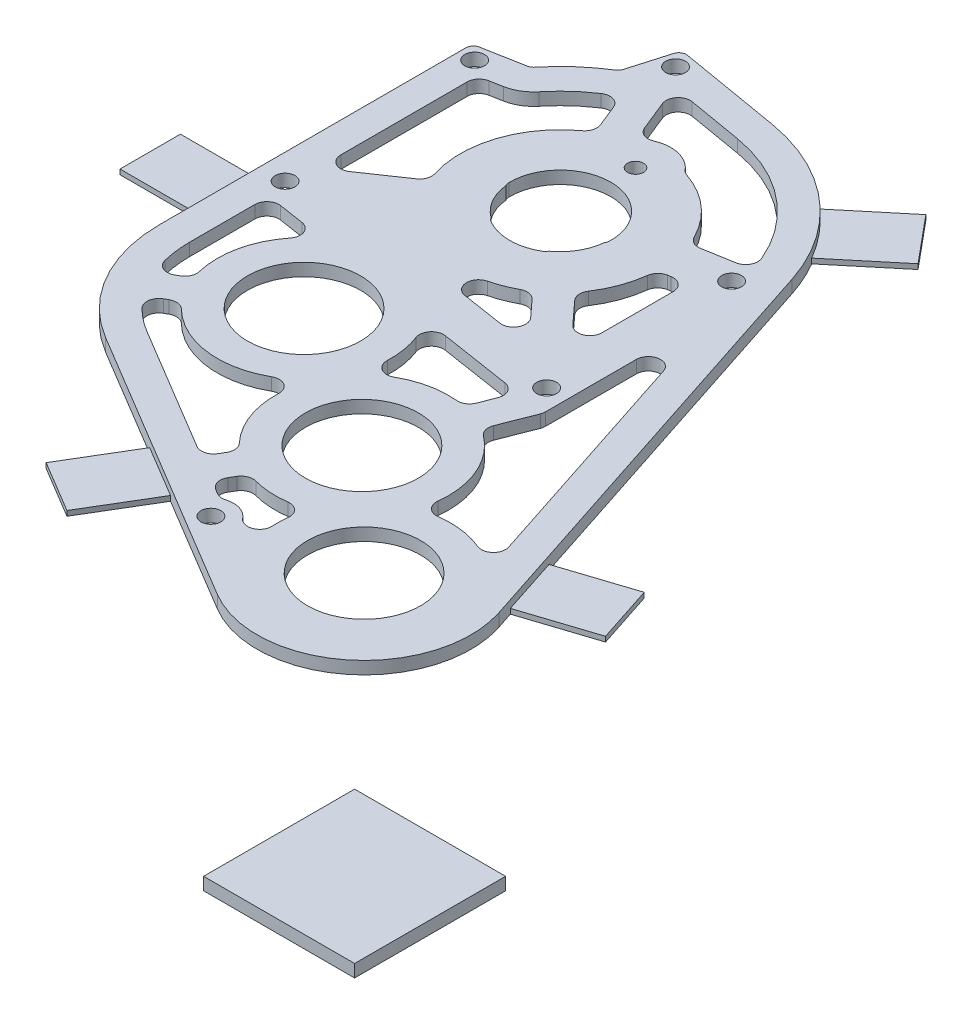
from build123d import *

# Parameters (mm, degrees)
SKETCH12_R                                   = 14.26845
BOSS_EXTRUDE2_DEPTH                          = 3.175
F_10_CLEARANCE_HOLE1_D                       = 4.9784
F_10_CLEARANCE_HOLE1_DEPTH                   = 15.875
F_10_CLEARANCE_HOLE1_TIP                     = 1.495662253
F_10_32_TAPPED_HOLE3_FOR_FIXTURE_CLAMP_D     = 4.0386
F_10_32_TAPPED_HOLE3_FOR_FIXTURE_CLAMP_DEPTH = 13.6144
F_10_32_TAPPED_HOLE3_FOR_FIXTURE_CLAMP_TIP   = 1.213317848
FILLET2_R                                    = 1.905
CUT_EXTRUDE3_DEPTH                           = 524.608729474
CUT_EXTRUDE5_DEPTH                           = 524.608729474
FILLET7_R                                    = 3.048
SKETCH36_W                                   = 38.1
SKETCH36_H                                   = 38.1
BOSS_EXTRUDE6_DEPTH                          = 3.175
SKETCH39_W                                   = 19.05
SKETCH39_H                                   = 15.24
BOSS_EXTRUDE8_DEPTH                          = 1.27


with BuildPart() as part:
    # Sketch12 → Boss-Extrude2 (new body)
    with BuildSketch(Plane(origin=(0, 0, 0), x_dir=(1, 0, 0), z_dir=(0, 1, 0))):
        with BuildLine():
            Line((200.025, 303.636994082), (200.025, 357.1875))
            Line((200.025, 357.1875), (200.025, 382.583822848))
            Line((200.025, 382.583822848), (212.514185037, 384.88822236))
            ThreePointArc((212.514185037, 384.88822236), (217.989123425, 390.685080707), (224.406085118, 395.418062818))
            Line((224.406085118, 395.418062818), (227.950504752, 407.613434459))
            Line((227.950504752, 407.613434459), (255.454885579, 402.919365135))
            ThreePointArc((255.454885579, 402.919365135), (277.962891885, 392.307982815), (291.750028527, 371.592610603))
            Line((291.750028527, 371.592610603), (327.631457191, 261.744649612))
            ThreePointArc((327.631457191, 261.744649612), (318.813781468, 232.272888197), (288.120666165, 230.206780978))
            Line((288.120666165, 230.206780978), (217.801878717, 272.283490022))
            ThreePointArc((217.801878717, 272.283490022), (204.77841907, 285.615759151), (200.025, 303.636994082))
        make_face()
        with Locations(Location((273.8165, 280.986369194, 0), (0, 0, 270))):
            Circle(SKETCH12_R, mode=Mode.SUBTRACT)
        with Locations(Location((301.97786819, 253.365, 0), (0, 0, 270))):
            Circle(SKETCH12_R, mode=Mode.SUBTRACT)
        with Locations(Location((236.5629, 303.636994082, 0), (0, 0, 270))):
            Circle(SKETCH12_R, mode=Mode.SUBTRACT)
    extrude(amount=BOSS_EXTRUDE2_DEPTH)

    # #10 Clearance Hole1
    with Locations(Plane(origin=(0, 3.175, 0), x_dir=(1, 0, 0), z_dir=(0, 1, 0))):
        with Locations((206.375, 329.036994082), (284.5435, 363.5375), (284.5435, 316.865), (270.22786819, 246.463302462), (203.835, 379.4125), (230.660405791, 403.285857222)):
            Hole(F_10_CLEARANCE_HOLE1_D / 2, depth=F_10_CLEARANCE_HOLE1_DEPTH)
            with Locations((0, 0, -(F_10_CLEARANCE_HOLE1_DEPTH + F_10_CLEARANCE_HOLE1_TIP / 2))):  # 118° drill point
                Cone(0, F_10_CLEARANCE_HOLE1_D / 2, F_10_CLEARANCE_HOLE1_TIP, mode=Mode.SUBTRACT)

    # #10-32 Tapped Hole3 for fixture clamp
    with Locations(Plane(origin=(0, 3.175, 0), x_dir=(1, 0, 0), z_dir=(0, 1, 0))):
        with Locations((247.65, 376.189598319)):
            Hole(F_10_32_TAPPED_HOLE3_FOR_FIXTURE_CLAMP_D / 2, depth=F_10_32_TAPPED_HOLE3_FOR_FIXTURE_CLAMP_DEPTH)
            with Locations((0, 0, -(F_10_32_TAPPED_HOLE3_FOR_FIXTURE_CLAMP_DEPTH + F_10_32_TAPPED_HOLE3_FOR_FIXTURE_CLAMP_TIP / 2))):  # 118° drill point
                Cone(0, F_10_32_TAPPED_HOLE3_FOR_FIXTURE_CLAMP_D / 2, F_10_32_TAPPED_HOLE3_FOR_FIXTURE_CLAMP_TIP, mode=Mode.SUBTRACT)

    # Fillet2
    fillet2_edges = [part.edges().sort_by_distance(p)[0] for p in [
        (200.025, 1.5875, -382.583822848),
        (212.514185037, 1.5875, -384.88822236),
        (224.406085118, 1.5875, -395.418062818),
        (227.950504752, 1.5875, -407.613434459),
    ]]
    fillet(fillet2_edges, radius=FILLET2_R)

    # Sketch32 → Cut-Extrude3 (cut, through all)
    with BuildSketch(Plane(origin=(0, 3.175, 0), x_dir=(1, 0, 0), z_dir=(0, 1, 0))):
        with BuildLine():
            ThreePointArc((235.218958599, 355.876313636), (236.824682453, 350.9375), (240.298958599, 347.077495533))
            ThreePointArc((240.298958599, 347.077495533), (240.33439426, 347.046203693), (240.36330567, 347.008800542))
            ThreePointArc((240.36330567, 347.008800542), (240.747259016, 346.53723237), (241.232296274, 346.17044146))
            ThreePointArc((241.232296274, 346.17044146), (247.733785279, 344.437775296), (254.2119412, 346.255737668))
            ThreePointArc((254.2119412, 346.255737668), (254.619434151, 346.579281042), (254.929679436, 346.996987496))
            ThreePointArc((254.929679436, 346.996987496), (254.960978458, 347.041125666), (255.001041401, 347.077495533))
            ThreePointArc((255.001041401, 347.077495533), (258.475317547, 350.9375), (260.081041401, 355.876313636))
            ThreePointArc((260.081041401, 355.876313636), (260.092507159, 355.929194096), (260.115082424, 355.978368929))
            ThreePointArc((260.115082424, 355.978368929), (260.321704182, 356.455902455), (260.398154488, 356.970573388))
            ThreePointArc((260.398154488, 356.970573388), (247.65, 369.9375), (234.901845512, 356.970573388))
            ThreePointArc((234.901845512, 356.970573388), (234.978295818, 356.455902455), (235.184917576, 355.978368929))
            ThreePointArc((235.184917576, 355.978368929), (235.207492841, 355.929194096), (235.218958599, 355.876313636))
        make_face()
    extrude(amount=-CUT_EXTRUDE3_DEPTH, mode=Mode.SUBTRACT)

    # Sketch35 → Cut-Extrude5 (cut, through all)
    with BuildSketch(Plane(origin=(0, 3.175, 0), x_dir=(1, 0, 0), z_dir=(0, 1, 0))):
        with BuildLine():
            Line((289.6235, 353.561825528), (289.6235, 310.932749926))
            Line((289.6235, 310.932749926), (285.217640386, 299.671075274))
            ThreePointArc((285.217640386, 299.671075274), (294.393774773, 288.44827286), (294.543959883, 273.952405147))
            ThreePointArc((294.543959883, 273.952405147), (306.58228572, 274.763681796), (317.221524362, 269.072806655))
            Line((317.221524362, 269.072806655), (289.6235, 353.561825528))
        make_face()
        with BuildLine():
            Line((278.121381686, 302.447315982), (281.910949933, 312.133708289))
            Line((281.910949933, 312.133708289), (254.324056617, 316.429396478))
            ThreePointArc((254.324056617, 316.429396478), (258.374123658, 305.474047687), (256.213545971, 293.995606407))
            ThreePointArc((256.213545971, 293.995606407), (265.93820509, 301.407845945), (278.121381686, 302.447315982))
        make_face()
        with BuildLine():
            Line((271.113298199, 366.380629914), (284.673889799, 368.714638796))
            Line((284.673889799, 368.714638796), (284.506662221, 369.22659189))
            ThreePointArc((284.506662221, 369.22659189), (272.984042958, 386.539493987), (254.172944339, 395.407972011))
            Line((254.172944339, 395.407972011), (234.968174449, 398.685577924))
            Line((234.968174449, 398.685577924), (241.480867326, 382.590684325))
            ThreePointArc((241.480867326, 382.590684325), (248.488209496, 385.039994064), (254.911143708, 381.318720277))
            ThreePointArc((254.911143708, 381.318720277), (264.731699814, 375.714656594), (271.113298199, 366.380629914))
        make_face()
        with BuildLine():
            ThreePointArc((215.933543638, 296.32030771), (215.627320845, 310.024933409), (223.532287987, 321.224131256))
            Line((223.532287987, 321.224131256), (207.645, 323.698017481))
            Line((207.645, 323.698017481), (207.645, 303.636994082))
            ThreePointArc((207.645, 303.636994082), (208.17541773, 298.123756305), (209.747212871, 292.81276828))
            Line((209.747212871, 292.81276828), (215.933543638, 296.32030771))
        make_face()
        with BuildLine():
            ThreePointArc((280.126111056, 252.098132367), (280.287469805, 256.302832762), (281.250408307, 260.398964047))
            ThreePointArc((281.250408307, 260.398964047), (273.622299168, 259.098780714), (266.018461281, 260.534111726))
            Line((266.018461281, 260.534111726), (262.395745292, 254.479812296))
            Line((262.395745292, 254.479812296), (267.448031844, 251.456671554))
            ThreePointArc((267.448031844, 251.456671554), (271.336318664, 252.069777517), (274.698750192, 250.023139413))
            ThreePointArc((274.698750192, 250.023139413), (278.171695759, 249.074698604), (280.126111056, 252.098132367))
        make_face()
        with BuildLine():
            Line((255.856954039, 258.392434044), (259.479670028, 264.446733474))
            ThreePointArc((259.479670028, 264.446733474), (252.365424811, 276.632564348), (254.165854029, 290.627756869))
            ThreePointArc((254.165854029, 290.627756869), (237.15704927, 281.756609487), (219.691882518, 289.691635983))
            Line((219.691882518, 289.691635983), (213.505551751, 286.184096553))
            ThreePointArc((213.505551751, 286.184096553), (217.255893246, 282.108305534), (221.714500466, 278.822281276))
            Line((221.714500466, 278.822281276), (255.856954039, 258.392434044))
        make_face()
        with BuildLine():
            Line((279.4635, 357.508448949), (272.836666851, 356.367858046))
            ThreePointArc((272.836666851, 356.367858046), (271.276344803, 348.421894988), (267.27641463, 341.381050406))
            Line((267.27641463, 341.381050406), (279.4635, 328.061258306))
            Line((279.4635, 328.061258306), (279.4635, 357.508448949))
        make_face()
        with BuildLine():
            Line((207.645, 376.241177152), (207.645, 336.052178963))
            Line((207.645, 336.052178963), (224.39612054, 347.476831123))
            ThreePointArc((224.39612054, 347.476831123), (223.725070852, 365.101902396), (234.774367335, 378.849865602))
            Line((234.774367335, 378.849865602), (230.057676635, 390.506278146))
            ThreePointArc((230.057676635, 390.506278146), (229.031941437, 389.465586282), (227.859094889, 388.594034086))
            ThreePointArc((227.859094889, 388.594034086), (223.033790673, 384.974053345), (218.858484663, 380.620360538))
            ThreePointArc((218.858484663, 380.620360538), (216.327672392, 378.439101282), (213.199293191, 377.266008675))
            Line((213.199293191, 377.266008675), (207.645, 376.241177152))
        make_face()
        with BuildLine():
            Line((273.035818564, 323.798135346), (261.654525021, 336.237242748))
            ThreePointArc((261.654525021, 336.237242748), (257.844635873, 334.141689114), (253.731228985, 332.732262237))
            ThreePointArc((253.731228985, 332.732262237), (251.421802493, 329.63837097), (253.997800828, 326.762636894))
            Line((253.997800828, 326.762636894), (273.035818564, 323.798135346))
        make_face()
    extrude(amount=-CUT_EXTRUDE5_DEPTH, mode=Mode.SUBTRACT)

    # Fillet7
    fillet7_edges = [part.edges().sort_by_distance(p)[0] for p in [
        (254.324056617, 1.5875, -316.429396478),
        (223.532287987, 1.5875, -321.224131256),
        (281.910949933, 1.5875, -312.133708289),
        (278.121381686, 1.5875, -302.447315982),
        (254.165854029, 1.5875, -290.627756869),
        (256.213545971, 1.5875, -293.995606407),
        (289.6235, 1.5875, -310.932749926),
        (289.6235, 1.5875, -353.561825528),
        (317.221524362, 1.5875, -269.072806655),
        (294.543959883, 1.5875, -273.952405147),
        (281.250408307, 1.5875, -260.398964047),
        (262.395745292, 1.5875, -254.479812296),
        (266.018461281, 1.5875, -260.534111726),
        (230.057676635, 1.5875, -390.506278146),
        (234.774367335, 1.5875, -378.849865602),
        (224.39612054, 1.5875, -347.476831123),
        (207.645, 1.5875, -336.052178963),
        (207.645, 1.5875, -376.241177152),
        (207.645, 1.5875, -323.698017481),
        (215.933543638, 1.5875, -296.32030771),
        (209.747212871, 1.5875, -292.81276828),
        (284.673889799, 1.5875, -368.714638796),
        (271.113298199, 1.5875, -366.380629914),
        (254.911143708, 1.5875, -381.318720277),
        (241.480867326, 1.5875, -382.590684325),
        (234.968174449, 1.5875, -398.685577924),
        (219.691882518, 1.5875, -289.691635983),
        (259.479670028, 1.5875, -264.446733474),
        (255.856954039, 1.5875, -258.392434044),
        (213.505551751, 1.5875, -286.184096553),
        (285.217640386, 1.5875, -299.671075274),
        (273.035818564, 1.5875, -323.798135346),
        (279.4635, 1.5875, -357.508448949),
        (279.4635, 1.5875, -328.061258306),
        (267.27641463, 1.5875, -341.381050406),
        (272.836666851, 1.5875, -356.367858046),
        (261.654525021, 1.5875, -336.237242748),
        (267.448031844, 1.5875, -251.456671554),
    ]]
    fillet(fillet7_edges, radius=FILLET7_R)

    # Sketch39 → Boss-Extrude8 (add)
    with BuildSketch(Plane.XZ):
        with Locations((190.5, -320.409047194)):
            Rectangle(SKETCH39_W, SKETCH39_H)
        Polygon((326.233514457, -266.024333131), (321.501477029, -280.511065743), (339.609892794, -286.426112528), (344.341930222, -271.939379916), align=None)
        Polygon((258.682246629, -247.821871603), (245.604664122, -255.647115099), (235.823109751, -239.300136966), (248.900692258, -231.47489347), align=None)
        Polygon((287.707648088, -380.590588627), (277.962891885, -392.307982815), (292.60963462, -404.488928068), (302.354390823, -392.77153388), align=None)
    extrude(amount=-BOSS_EXTRUDE8_DEPTH)


with BuildPart() as body_2:
    # Sketch36 → Boss-Extrude6 (new, through all)
    with BuildSketch(Plane.XZ):
        with Locations((367.032107769, -185.924197665)):
            Rectangle(SKETCH36_W, SKETCH36_H)
    extrude(amount=-BOSS_EXTRUDE6_DEPTH)


solid = Compound([part.part, body_2.part])
